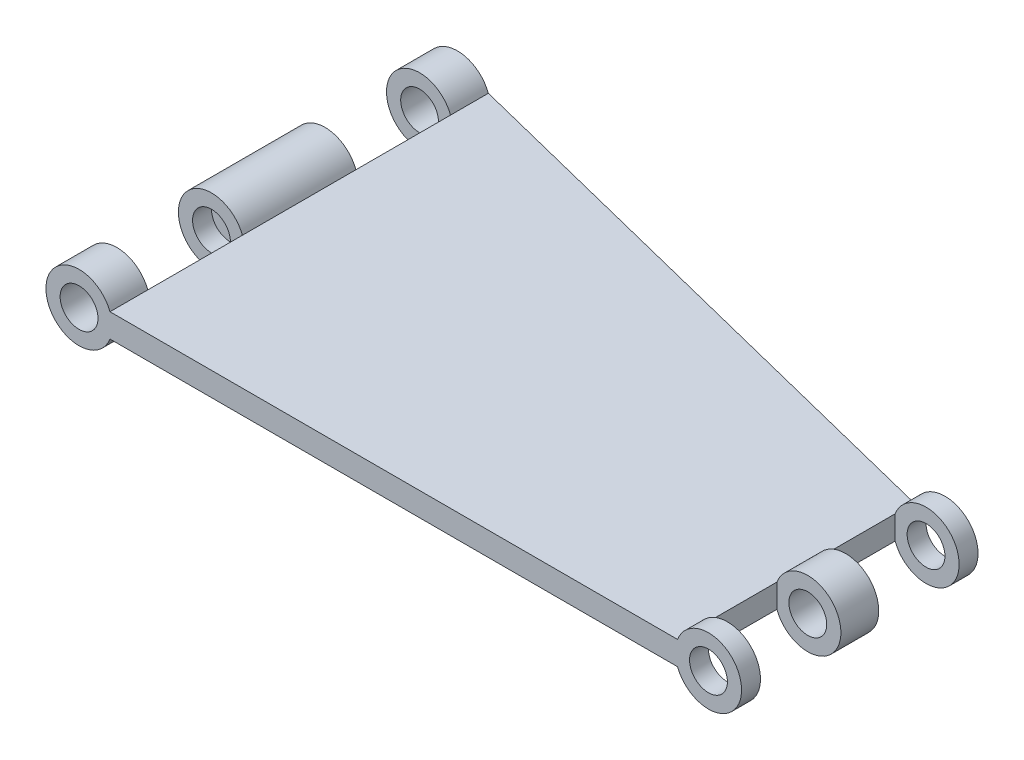
from build123d import *

# Parameters (mm, degrees)
EXTRUDE_1_DEPTH          = 5
SKETCH_3_R               = 7
SKETCH_3_R_2             = 1.5
EXTRUDE_2_DEPTH          = 80
CUT_EXTRUDE_1_DEPTH      = 80
CUT_EXTRUDE_1_DEPTH_BACK = 80
SKETCH_4_W               = 13.538348415
SKETCH_4_H               = 20
SKETCH_5_R               = 7
SKETCH_5_R_2             = 4
EXTRUDE_3_DEPTH          = 50
CUT_EXTRUDE_2_DEPTH      = 50
CUT_EXTRUDE_2_DEPTH_BACK = 50
SKETCH_6_W               = 13.538348415
SKETCH_6_H               = 17
SKETCH_7_R               = 4
CUT_EXTRUDE_3_DEPTH      = 32
CUT_EXTRUDE_START        = -32
SKETCH_8_R               = 4
CUT_EXTRUDE_4_DEPTH      = 32


with BuildPart() as part:
    # 草图1 → 凸台-拉伸1 (new body)
    with BuildSketch(Plane(origin=(0, 0, 0), x_dir=(1, 0, 0), z_dir=(0, 1, 0))):
        Polygon((-79.492600423, 46.934460888), (-79.492600423, -33.065539112), (40.507399577, -33.065539112), (40.507399577, 16.934460888), align=None)
    extrude(amount=EXTRUDE_1_DEPTH)

    # 草图3 → 凸台-拉伸2 (add)
    with BuildSketch(Plane.XY.offset(33.065539112)):
        with Locations((-86.030948838, 2.5)):
            Circle(SKETCH_3_R)
        with Locations((-86.030948838, 2.5)):
            Circle(SKETCH_3_R_2, mode=Mode.SUBTRACT)
    extrude(amount=-EXTRUDE_2_DEPTH)

    # 草图4 → 切除-拉伸1 (cut, two sides: drawn at the far end of the back side and taken through both)
    with BuildSketch(Plane(origin=(0, 5, 0), x_dir=(1, 0, 0), z_dir=(0, 1, 0)).offset(-CUT_EXTRUDE_1_DEPTH_BACK)):
        with Locations((-86.26177463, 28.934460888)):
            Rectangle(SKETCH_4_W, SKETCH_4_H)
        with Locations((-86.26177463, -15.065539112)):
            Rectangle(SKETCH_4_W, SKETCH_4_H)
    extrude(amount=CUT_EXTRUDE_1_DEPTH + CUT_EXTRUDE_1_DEPTH_BACK, mode=Mode.SUBTRACT)

    # 草图5 → 凸台-拉伸3 (add)
    with BuildSketch(Plane.XY.offset(33.065539112)):
        with Locations((47.045747992, 2.5)):
            Circle(SKETCH_5_R)
        with Locations((47.045747992, 2.5)):
            Circle(SKETCH_5_R_2, mode=Mode.SUBTRACT)
    extrude(amount=-EXTRUDE_3_DEPTH)

    # 草图6 → 切除-拉伸2 (cut, two sides: drawn at the far end of the back side and taken through both)
    with BuildSketch(Plane(origin=(0, 5, 0), x_dir=(1, 0, 0), z_dir=(0, 1, 0)).offset(-CUT_EXTRUDE_2_DEPTH_BACK)):
        with Locations((47.276573785, 4.434460888)):
            Rectangle(SKETCH_6_W, SKETCH_6_H)
        with Locations((47.276573785, -20.565539112)):
            Rectangle(SKETCH_6_W, SKETCH_6_H)
    extrude(amount=CUT_EXTRUDE_2_DEPTH + CUT_EXTRUDE_2_DEPTH_BACK, mode=Mode.SUBTRACT)

    # 草图7 → 切除-拉伸3 (cut)
    with BuildSketch(Plane.XY.offset(33.065539112)):
        with Locations((-86.030948838, 2.5)):
            Circle(SKETCH_7_R)
    extrude(amount=-CUT_EXTRUDE_3_DEPTH, mode=Mode.SUBTRACT)

    # 草图8 → 切除-拉伸4 (cut)
    with BuildSketch(Plane(origin=(0, 0, -46.934460888), x_dir=(-1, 0, 0), z_dir=(0, 0, -1)).offset(CUT_EXTRUDE_START)):
        with Locations((86.030948838, 2.5)):
            Circle(SKETCH_8_R)
    extrude(amount=CUT_EXTRUDE_4_DEPTH, mode=Mode.SUBTRACT)


solid = part.part
